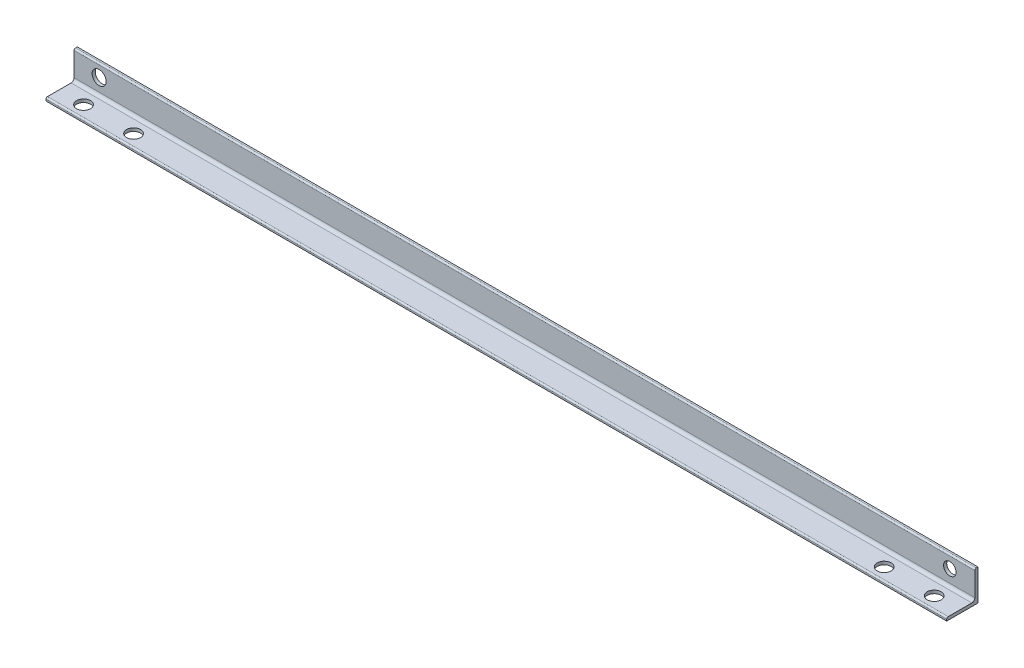
from build123d import *

# Parameters (mm, degrees)
BOSS_EXTRUDE1_DEPTH = 457.2
FILLET1_R           = 0.762
FILLET2_R           = 1.524
SKETCH2_R           = 3.556
CUT_EXTRUDE1_DEPTH  = 463.273528266
SKETCH3_R           = 3.556
SKETCH3_R_2         = 3.175
CUT_EXTRUDE2_DEPTH  = 458.600012933


with BuildPart() as part:
    # Sketch1 → Boss-Extrude1 (new body)
    with BuildSketch(Plane(origin=(0, 0, 0), x_dir=(0, 0, -1), z_dir=(1, 0, 0))):
        Polygon((-50.917252699, 3.14071867), (-50.917252699, -12.73428133), (-66.792252699, -12.73428133), (-66.792252699, -11.13408133), (-52.517452699, -11.13408133), (-52.517452699, 3.14071867), align=None)
    extrude(amount=BOSS_EXTRUDE1_DEPTH)

    # Fillet1
    fillet1_edges = [part.edges().sort_by_distance(p)[0] for p in [
        (228.6, -11.13408133, 66.792252699),
        (228.6, 3.14071867, 52.517452699),
    ]]
    fillet(fillet1_edges, radius=FILLET1_R)

    # Fillet2
    fillet2_edges = [part.edges().sort_by_distance(p)[0] for p in [
        (228.6, -11.13408133, 52.517452699),
    ]]
    fillet(fillet2_edges, radius=FILLET2_R)

    # Sketch2 → Cut-Extrude1 (cut, through all)
    with BuildSketch(Plane(origin=(0, -11.13408133, 0), x_dir=(1, 0, 0), z_dir=(0, 1, 0))):
        with Locations(Location((444.5, -60.442252699, 0), (0, 0, 270))):
            Circle(SKETCH2_R)
        with Locations(Location((419.1, -60.442252699, 0), (0, 0, 270))):
            Circle(SKETCH2_R)
        with Locations(Location((12.7, -60.442252699, 0), (0, 0, 270))):
            Circle(SKETCH2_R)
        with Locations(Location((38.1, -60.442252699, 0), (0, 0, 270))):
            Circle(SKETCH2_R)
    extrude(amount=-CUT_EXTRUDE1_DEPTH, mode=Mode.SUBTRACT)

    # Sketch3 → Cut-Extrude2 (cut, through all)
    with BuildSketch(Plane.XY.offset(52.517452699)):
        with Locations((12.7, -3.20928133)):
            Circle(SKETCH3_R)
        with Locations((444.5, -3.20928133)):
            Circle(SKETCH3_R_2)
    extrude(amount=-CUT_EXTRUDE2_DEPTH, mode=Mode.SUBTRACT)


solid = part.part
